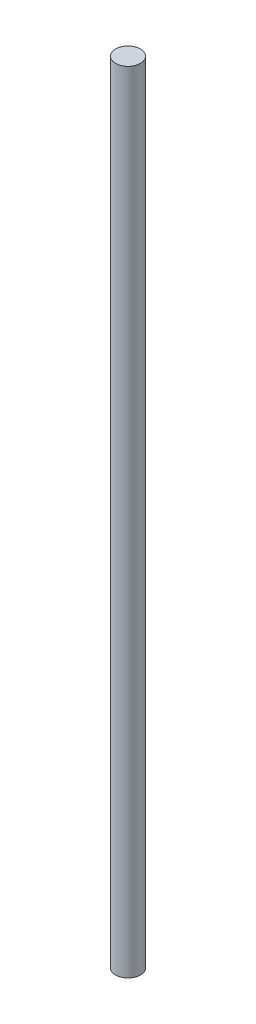
from build123d import *

# Parameters (mm, degrees)
SKETCH1_R           = 1.5
BOSS_EXTRUDE1_DEPTH = 95


with BuildPart() as part:
    # Sketch1 → Boss-Extrude1 (new body)
    with BuildSketch(Plane(origin=(0, 0, 0), x_dir=(1, 0, 0), z_dir=(0, 1, 0))):
        with Locations(Location((0, 0, 0), (0, 0, 270))):
            Circle(SKETCH1_R)
    extrude(amount=BOSS_EXTRUDE1_DEPTH)


solid = part.part
